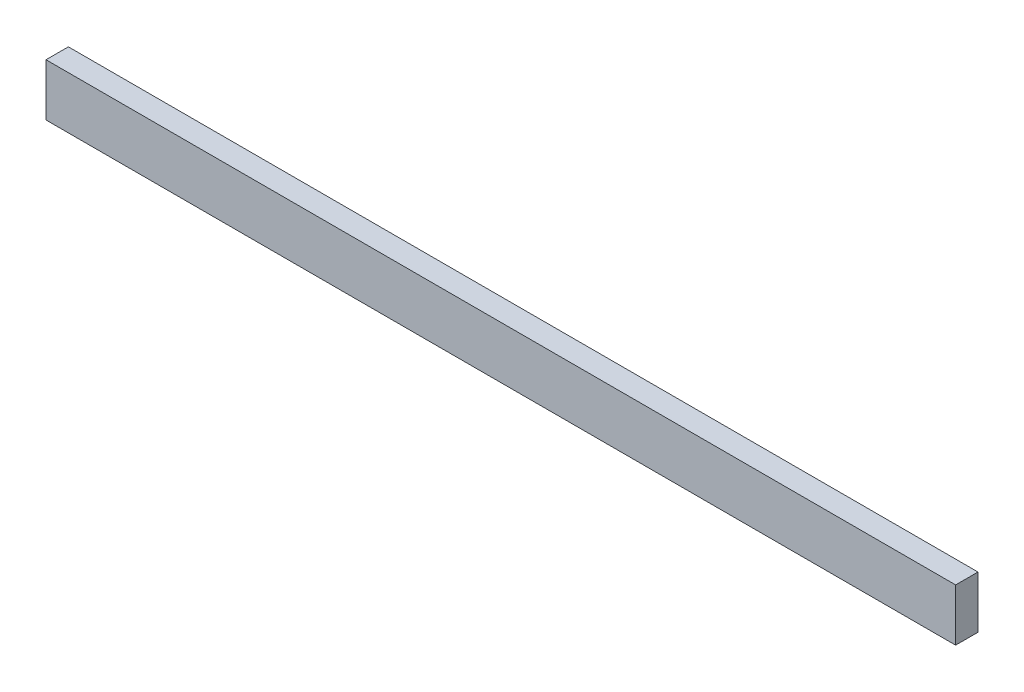
from build123d import *

# Parameters (mm, degrees)
SKETCH1_W           = 774.7
SKETCH1_H           = 44.45
BOSS_EXTRUDE1_DEPTH = 19.05


with BuildPart() as part:
    # Sketch1 → Boss-Extrude1 (new body)
    with BuildSketch(Plane.XY):
        with Locations((387.35, 22.225)):
            Rectangle(SKETCH1_W, SKETCH1_H)
    extrude(amount=BOSS_EXTRUDE1_DEPTH)


solid = part.part
